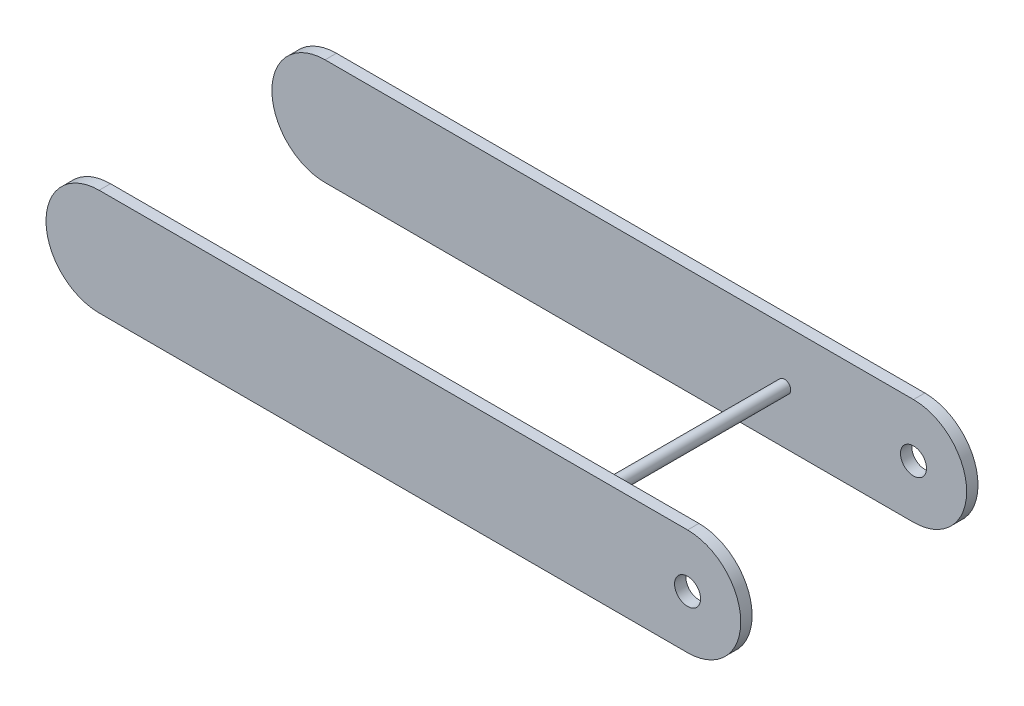
from build123d import *

# Parameters (mm, degrees)
SKETCH1_R           = 6.2
BOSS_EXTRUDE1_DEPTH = 5.4
SKETCH2_R           = 3
BOSS_EXTRUDE3_DEPTH = 102.1
BOSS_EXTRUDE4_START = 5.4
SKETCH4_R           = 6.2
BOSS_EXTRUDE4_DEPTH = 5.4


with BuildPart() as part:
    # Sketch1 → Boss-Extrude1 (new body)
    with BuildSketch(Plane.XY):
        with BuildLine():
            Line((0, 0), (-149.578947368, 0))
            ThreePointArc((-149.578947368, 0), (-174.878947368, -25.3), (-149.578947368, -50.6))
            Line((-149.578947368, -50.6), (130.421052632, -50.6))
            ThreePointArc((130.421052632, -50.6), (155.721052632, -25.3), (130.421052632, 0))
            Line((130.421052632, 0), (0, 0))
        make_face()
        with Locations(Location((130.421052632, -25.3, 0), (0, 0, 180))):
            Circle(SKETCH1_R, mode=Mode.SUBTRACT)
    extrude(amount=BOSS_EXTRUDE1_DEPTH)

    # Sketch2 → Boss-Extrude3 (add)
    with BuildSketch(Plane(origin=(0, 0, 0), x_dir=(-1, 0, 0), z_dir=(0, 0, -1))):
        with Locations(Location((-68.985809966, -25.3, 0), (0, 0, 180))):
            Circle(SKETCH2_R)
    extrude(amount=BOSS_EXTRUDE3_DEPTH)

    # Sketch4 → Boss-Extrude4 (add)
    with BuildSketch(Plane(origin=(0, 0, -102.1), x_dir=(-1, 0, 0), z_dir=(0, 0, -1)).offset(BOSS_EXTRUDE4_START)):
        with BuildLine():
            Line((-130.421052632, 0), (149.578947368, 0))
            ThreePointArc((149.578947368, 0), (174.878947368, -25.3), (149.578947368, -50.6))
            Line((149.578947368, -50.6), (-130.421052632, -50.6))
            ThreePointArc((-130.421052632, -50.6), (-155.721052632, -25.3), (-130.421052632, 0))
        make_face()
        with Locations((-130.421052632, -25.3)):
            Circle(SKETCH4_R, mode=Mode.SUBTRACT)
    extrude(amount=-BOSS_EXTRUDE4_DEPTH)


solid = part.part
